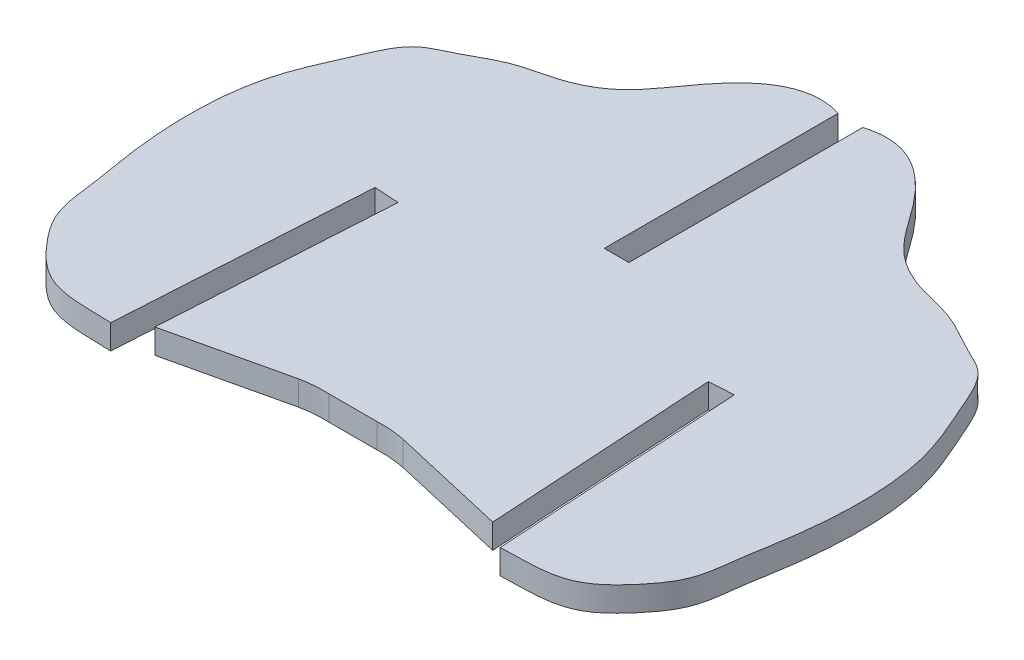
from build123d import *

# Parameters (mm, degrees)
EXTRUDE_1_DEPTH = 4


with BuildPart() as part:
    # Эскиз1 → Бобышка-Вытянуть1 (new body)
    with BuildSketch(Plane(origin=(0, 0, 0), x_dir=(1, 0, 0), z_dir=(0, 1, 0))):
        with BuildLine():
            Line((322.506185164, 279.216996549), (322.506185164, 241.148279103))
            Line((322.506185164, 241.148279103), (326.506185164, 241.148279103))
            Line((326.506185164, 241.148279103), (326.506185164, 279.216996549))
            add(Edge.make_bspline(
                [(326.506185164, 279.216996549), (333.228337001, 281.311766086), (340.78265111, 274.499419386), (346.685136371, 264.616389153), (353.60679963, 261.075530259), (360.44019493, 259.998183265), (365.414819015, 256.712650418), (371.264337857, 254.266266236), (374.150175863, 247.227227303), (378.146468371, 238.886306312), (379.671432599, 226.577719389), (378.696591797, 216.620970327), (377.0562995, 207.840217504), (376.707695621, 201.864992605), (372.502800727, 196.127844551), (367.871454499, 191.472787985), (361.618584455, 190.510159582), (357.86512227, 190.604513312), (356.196418644, 190.503683274)],
                knots=[0, 0, 0, 0, 0.136915078, 0.211026498, 0.260495211, 0.308388453, 0.367334171, 0.39572498, 0.449167004, 0.529310598, 0.610954999, 0.727155916, 0.756820744, 0.816073262, 0.859025792, 0.916880577, 0.959528089, 1, 1, 1, 1], degree=3))
            Line((356.196418644, 190.503683274), (353.744795566, 231.077230675))
            Line((353.744795566, 231.077230675), (349.752077793, 230.835974003))
            Line((349.752077793, 230.835974003), (352.008890416, 193.486474909))
            Line((352.008890416, 193.486474909), (332.973780039, 197.87949925))
            add(Edge.make_bspline(
                [(332.973780039, 197.87949925), (330.723503611, 198.328988408), (328.44070128, 198.235143432)],
                knots=[0, 0, 0, 1, 1, 1], degree=2))
            Line((328.44070128, 198.235143432), (324.506185164, 198.235143432))
            Line((324.506185164, 198.235143432), (320.571669047, 198.235143432))
            add(Edge.make_bspline(
                [(316.038590288, 197.87949925), (318.288866716, 198.328988408), (320.571669047, 198.235143432)],
                knots=[0, 0, 0, 1, 1, 1], degree=2))
            Line((316.038590288, 197.87949925), (297.003479911, 193.486474909))
            Line((297.003479911, 193.486474909), (299.260292534, 230.835974003))
            Line((299.260292534, 230.835974003), (295.267574761, 231.077230675))
            Line((295.267574761, 231.077230675), (292.815951683, 190.503683274))
            add(Edge.make_bspline(
                [(322.506185164, 279.216996549), (315.784033326, 281.311766086), (308.229719217, 274.499419386), (302.327233956, 264.616389153), (295.405570697, 261.075530259), (288.572175397, 259.998183265), (283.597551312, 256.712650418), (277.74803247, 254.266266236), (274.862194464, 247.227227303), (270.865901956, 238.886306312), (269.340937728, 226.577719389), (270.31577853, 216.620970327), (271.956070827, 207.840217504), (272.304674706, 201.864992605), (276.5095696, 196.127844551), (281.140915828, 191.472787985), (287.393785872, 190.510159582), (291.147248057, 190.604513312), (292.815951683, 190.503683274)],
                knots=[0, 0, 0, 0, 0.136915078, 0.211026498, 0.260495211, 0.308388453, 0.367334171, 0.39572498, 0.449167004, 0.529310598, 0.610954999, 0.727155916, 0.756820744, 0.816073262, 0.859025792, 0.916880577, 0.959528089, 1, 1, 1, 1], degree=3))
        make_face()
    extrude(amount=EXTRUDE_1_DEPTH)


solid = part.part
